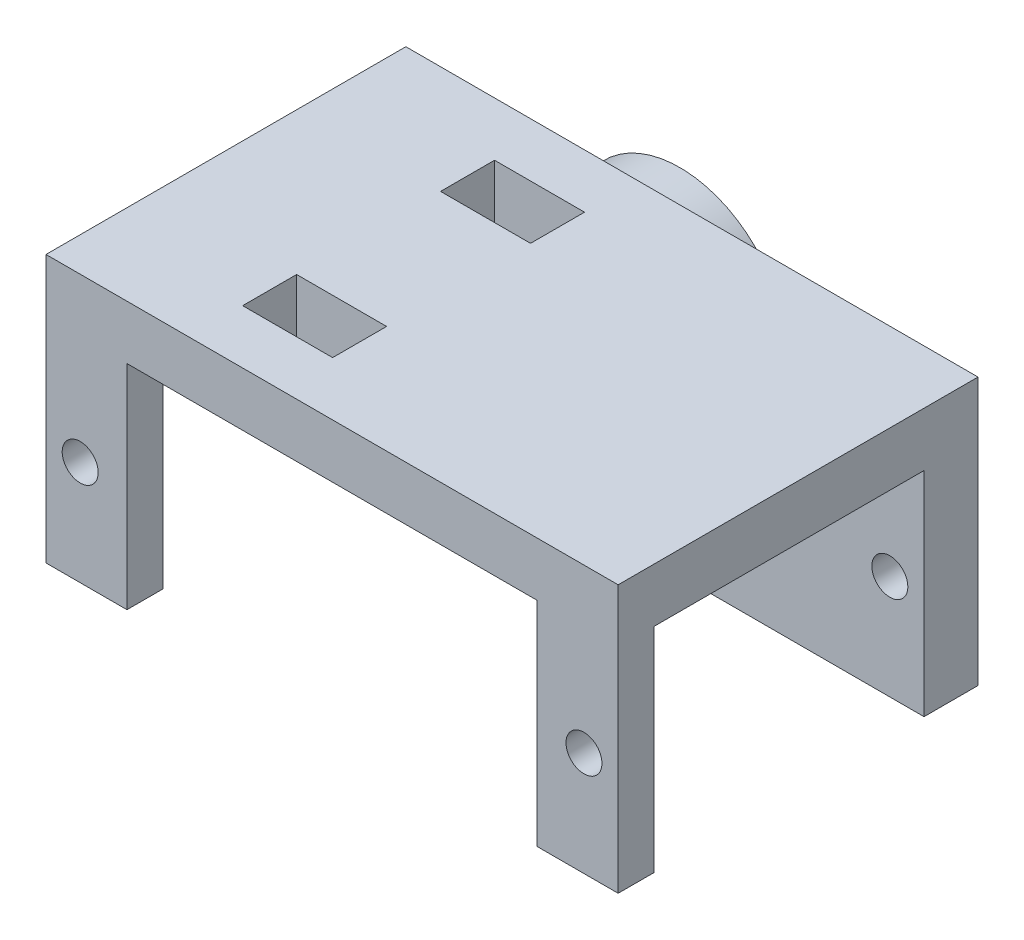
from build123d import *

# Parameters (mm, degrees)
SKETCH1_W            = 31.8
SKETCH1_H            = 13.25
BOSS_EXTRUDE3_DEPTH  = 3
SKETCH3_W            = 31.8
SKETCH3_H            = 3
BOSS_EXTRUDE4_DEPTH  = 24
SKETCH4_W            = 22.8
SKETCH4_H            = 13.25
CUT_EXTRUDE3_DEPTH   = 3
SKETCH6_W            = 31.8
SKETCH6_H            = 2
BOSS_EXTRUDE5_DEPTH  = 13.25
SKETCH7_W            = 3.6
SKETCH7_H            = 3
CUT_EXTRUDE4_DEPTH   = 40.30496947
SKETCH8_W            = 2
SKETCH8_H            = 1.25
BOSS_EXTRUDE6_DEPTH  = 31.8
SKETCH10_W           = 2
SKETCH10_H           = 17.5
CUT_EXTRUDE6_DEPTH   = 38.505207972
BOSS_EXTRUDE7_START  = -31.8
SKETCH11_W           = 3
SKETCH11_H           = 1.25
BOSS_EXTRUDE7_DEPTH  = 31.8
SKETCH12_W           = 22.8
SKETCH12_H           = 1.25
CUT_EXTRUDE7_DEPTH   = 4
SKETCH15_W           = 31.8
SKETCH15_H           = 3
BOSS_EXTRUDE9_DEPTH  = 17.5
BOSS_EXTRUDE12_DEPTH = 5
SKETCH20_W           = 15
SKETCH20_H           = 14.5
SKETCH20_W_2         = 5.230602644
SKETCH20_H_2         = 17.5
CUT_EXTRUDE9_DEPTH   = 100
SKETCH22_R           = 1
SKETCH22_W           = 31.8
SKETCH22_H           = 2.65
CUT_EXTRUDE11_DEPTH  = 20
SKETCH24_R           = 5.925
BOSS_EXTRUDE13_DEPTH = 4.8
SKETCH25_R           = 2.5
BOSS_EXTRUDE14_DEPTH = 2
SKETCH27_W           = 5
SKETCH27_H           = 3
CUT_EXTRUDE12_DEPTH  = 10


with BuildPart() as part:
    # Sketch1 → Boss-Extrude3 (new body)
    with BuildSketch(Plane.XY):
        Rectangle(SKETCH1_W, SKETCH1_H)
    extrude(amount=BOSS_EXTRUDE3_DEPTH)

    # Sketch3 → Boss-Extrude4 (add)
    with BuildSketch(Plane.XY.offset(3)):
        with Locations((0, 8.125)):
            Rectangle(SKETCH3_W, SKETCH3_H)
    extrude(amount=-BOSS_EXTRUDE4_DEPTH)

    # Sketch4 → Cut-Extrude3 (cut)
    with BuildSketch(Plane.XY.offset(3)):
        Rectangle(SKETCH4_W, SKETCH4_H)
    extrude(amount=-CUT_EXTRUDE3_DEPTH, mode=Mode.SUBTRACT)

    # Sketch6 → Boss-Extrude5 (add)
    with BuildSketch(Plane.XZ.offset(-6.625)):
        with Locations((0, -16.4)):
            Rectangle(SKETCH6_W, SKETCH6_H)
    extrude(amount=BOSS_EXTRUDE5_DEPTH)

    # Sketch7 → Cut-Extrude4 (cut, through all)
    with BuildSketch(Plane.ZY.offset(15.9)):
        with Locations((-19.2, 8.125)):
            Rectangle(SKETCH7_W, SKETCH7_H)
    extrude(amount=-CUT_EXTRUDE4_DEPTH, mode=Mode.SUBTRACT)

    # Sketch8 → Boss-Extrude6 (add)
    with BuildSketch(Plane(origin=(15.9, 0, 0), x_dir=(0, 0, -1), z_dir=(1, 0, 0))):
        with Locations((16.4, -7.25)):
            Rectangle(SKETCH8_W, SKETCH8_H)
    extrude(amount=-BOSS_EXTRUDE6_DEPTH)

    # Sketch10 → Cut-Extrude6 (cut, through all)
    with BuildSketch(Plane(origin=(15.9, 0, 0), x_dir=(0, 0, -1), z_dir=(1, 0, 0))):
        with Locations((16.4, 0.875)):
            Rectangle(SKETCH10_W, SKETCH10_H)
    extrude(amount=-CUT_EXTRUDE6_DEPTH, mode=Mode.SUBTRACT)

    # Sketch11 → Boss-Extrude7 (add)
    with BuildSketch(Plane(origin=(15.9, 0, 0), x_dir=(0, 0, -1), z_dir=(1, 0, 0)).offset(BOSS_EXTRUDE7_START)):
        with Locations((-1.5, -7.25)):
            Rectangle(SKETCH11_W, SKETCH11_H)
    boss_extrude7 = extrude(amount=BOSS_EXTRUDE7_DEPTH)

    # Mirror2: Boss-Extrude7 across plane
    add(boss_extrude7.mirror(Plane(origin=(0, 0, 0), x_dir=(0, 0, 1), z_dir=(1, 0, 0))))

    # Sketch12 → Cut-Extrude7 (cut)
    with BuildSketch(Plane.XY.offset(3)):
        with Locations((0, -7.25)):
            Rectangle(SKETCH12_W, SKETCH12_H)
    extrude(amount=-CUT_EXTRUDE7_DEPTH, mode=Mode.SUBTRACT)

    # Sketch15 → Boss-Extrude9 (add)
    with BuildSketch(Plane(origin=(0, 9.625, 0), x_dir=(1, 0, 0), z_dir=(0, 1, 0))):
        with Locations((0, 16.9)):
            Rectangle(SKETCH15_W, SKETCH15_H)
    extrude(amount=-BOSS_EXTRUDE9_DEPTH)

    # Sketch19 → Boss-Extrude12 (add)
    with BuildSketch(Plane.XY.offset(3)):
        Polygon((-15.9, 9.625), (15.9, 9.625), (15.9, -7.875), (11.4, -7.875), (11.4, 6.625), (-11.4, 6.625), (-11.4, -7.875), (-15.9, -7.875), align=None)
    extrude(amount=-BOSS_EXTRUDE12_DEPTH)

    # Sketch20 → Cut-Extrude9 (cut)
    with BuildSketch(Plane.ZY.offset(15.9)):
        with Locations((-7.9, -0.625)):
            Rectangle(SKETCH20_W, SKETCH20_H)
        with Locations((4.215301322, 0.875)):
            Rectangle(SKETCH20_W_2, SKETCH20_H_2)
    extrude(amount=-CUT_EXTRUDE9_DEPTH, mode=Mode.SUBTRACT)

    # Sketch22 → Cut-Extrude11 (cut)
    with BuildSketch(Plane.XY.offset(1.6)):
        with Locations((-14, 0.575)):
            Circle(SKETCH22_R)
        with Locations((14, 0.575)):
            Circle(SKETCH22_R)
        with Locations((0, -6.55)):
            Rectangle(SKETCH22_W, SKETCH22_H)
    extrude(amount=-CUT_EXTRUDE11_DEPTH, mode=Mode.SUBTRACT)

    # Sketch24 → Boss-Extrude13 (add)
    with BuildSketch(Plane(origin=(0, 0, -18.4), x_dir=(-1, 0, 0), z_dir=(0, 0, -1))):
        with Locations(Location((5.47, 0.7, 0), (0, 0, 270))):
            Circle(SKETCH24_R)
    extrude(amount=BOSS_EXTRUDE13_DEPTH)

    # Sketch25 → Boss-Extrude14 (add)
    with BuildSketch(Plane(origin=(0, 0, -23.2), x_dir=(-1, 0, 0), z_dir=(0, 0, -1))):
        with Locations((5.47, 0.7)):
            Circle(SKETCH25_R)
    extrude(amount=BOSS_EXTRUDE14_DEPTH)

    # Sketch27 → Cut-Extrude12 (cut)
    with BuildSketch(Plane.XZ.offset(-6.625)):
        with Locations((-5.47, -13.9)):
            Rectangle(SKETCH27_W, SKETCH27_H)
        with Locations((-5.47, -2.9)):
            Rectangle(SKETCH27_W, SKETCH27_H)
    extrude(amount=-CUT_EXTRUDE12_DEPTH, mode=Mode.SUBTRACT)


solid = part.part
